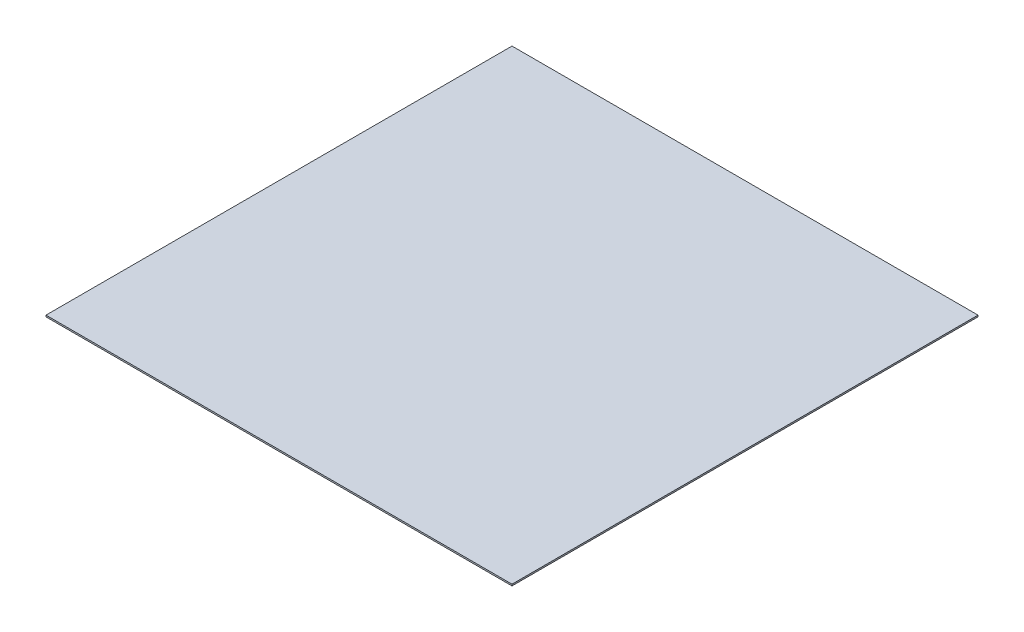
from build123d import *

# Parameters (mm, degrees)
SKETCH_1_W      = 3000
SKETCH_1_H      = 3000
EXTRUDE_1_DEPTH = 10


with BuildPart() as part:
    # Эскиз1 → Бобышка-Вытянуть1 (new body)
    with BuildSketch(Plane(origin=(0, 0, 0), x_dir=(1, 0, 0), z_dir=(0, 1, 0))):
        with Locations((1500, 1500)):
            Rectangle(SKETCH_1_W, SKETCH_1_H)
    extrude(amount=EXTRUDE_1_DEPTH)


solid = part.part
